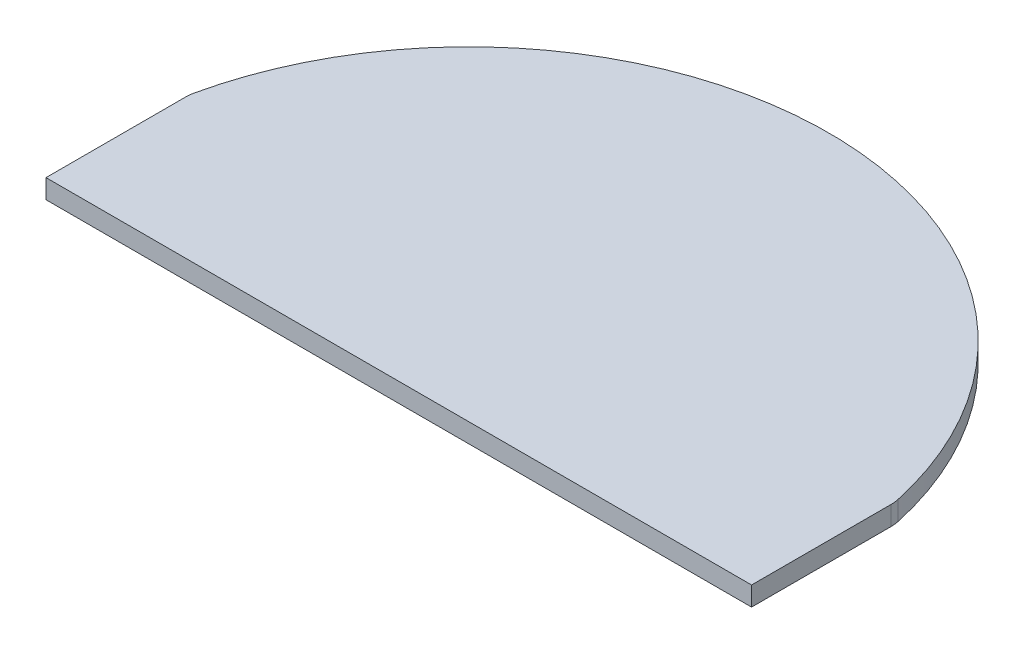
from build123d import *

# Parameters (mm, degrees)
BOSS_EXTRUDE1_DEPTH = 6.8
FILLET1_R           = 12.7


with BuildPart() as part:
    # Sketch1 → Boss-Extrude1 (new body)
    with BuildSketch(Plane(origin=(0, 0, 0), x_dir=(1, 0, 0), z_dir=(0, 1, 0))):
        with BuildLine():
            Line((0, 0), (250, 0))
            Line((250, 0), (250, 50.8))
            ThreePointArc((250, 50.8), (125, 152.4), (0, 50.8))
            Line((0, 50.8), (0, 0))
        make_face()
    extrude(amount=BOSS_EXTRUDE1_DEPTH)

    # Fillet1
    fillet1_edges = [part.edges().sort_by_distance(p)[0] for p in [
        (0, 3.4, -50.8),
        (250, 3.4, -50.8),
    ]]
    fillet(fillet1_edges, radius=FILLET1_R)


solid = part.part
